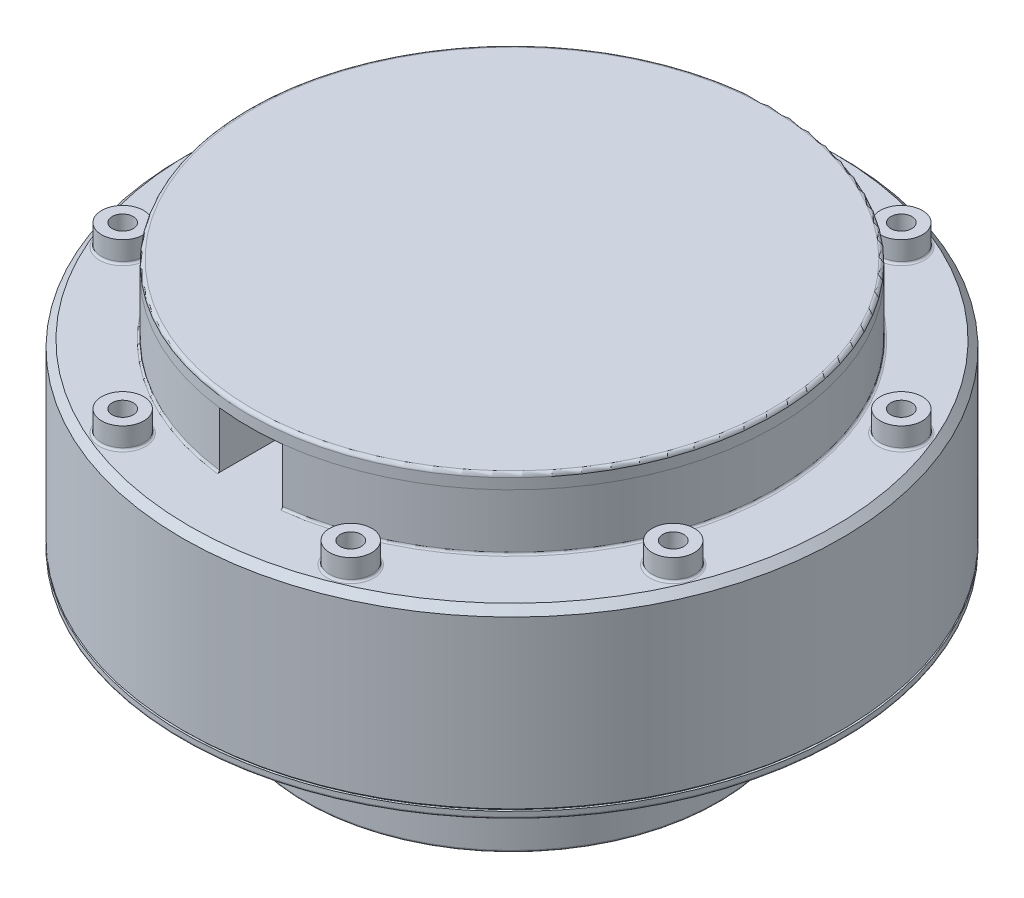
from build123d import *

# Parameters (mm, degrees)
SKETCH_1_R               = 47
SKETCH_1_R_2             = 1.5
EXTRUDE_1_DEPTH          = 25
SKETCH_2_R               = 3
SKETCH_2_R_2             = 1.5
EXTRUDE_2_DEPTH          = 3
EXTRUDE_3_DEPTH          = 8
SKETCH_4_R               = 37.505
EXTRUDE_4_DEPTH          = 2
FILLET_1_R               = 0.5
CHAMFER_1_SIZE           = 1
FILLET_2_R               = 0.3
CHAMFER_2_SIZE           = 0.3
EXTRUDE_START            = 1
SKETCH_5_R               = 47
SKETCH_5_R_2             = 1.5
EXTRUDE_5_DEPTH          = 1
FILLET_3_R               = 0.3
SKETCH_6_R               = 29.5
SKETCH_6_R_2             = 27.5
EXTRUDE_6_DEPTH          = 16.5
SKETCH_7_R               = 27.5
SKETCH_7_R_2             = 22
EXTRUDE_7_DEPTH          = 7.5
SKETCH_8_R               = 21
EXTRUDE_8_DEPTH          = 7
SKETCH_9_R               = 20
EXTRUDE_9_DEPTH          = 10
SKETCH_10_R              = 9.75
CUT_EXTRUDE_1_DEPTH      = 5.5
CUT_EXTRUDE_2_DEPTH      = 5.6
SKETCH_12_R              = 1.5
CUT_EXTRUDE_3_DEPTH      = 6
SKETCH_13_R              = 2
EXTRUDE_10_DEPTH         = 2.6
CHAMFER_3_SIZE           = 0.5
CHAMFER_4_SIZE           = 0.2
FILLET_4_R               = 0.3
CUT_EXTRUDE_4_DEPTH      = 6
CUT_EXTRUDE_4_DEPTH_BACK = 26
SKETCH_15_R              = 19.25


with BuildPart() as part:
    # 草图1 → 凸台-拉伸1 (new body)
    with BuildSketch(Plane(origin=(0, 0, 0), x_dir=(1, 0, 0), z_dir=(0, 1, 0))):
        with Locations(Location((0, 0, 0), (0, 0, 270))):
            Circle(SKETCH_1_R)
        with Locations(Location((-16.264045876, 39.264880132, 0), (0, 0, 270))):
            Circle(SKETCH_1_R_2, mode=Mode.SUBTRACT)
        with Locations(Location((16.264045876, 39.264880132, 0), (0, 0, 270))):
            Circle(SKETCH_1_R_2, mode=Mode.SUBTRACT)
        with Locations(Location((39.264880132, 16.264045876, 0), (0, 0, 270))):
            Circle(SKETCH_1_R_2, mode=Mode.SUBTRACT)
        with Locations(Location((39.264880132, -16.264045876, 0), (0, 0, 270))):
            Circle(SKETCH_1_R_2, mode=Mode.SUBTRACT)
        with Locations(Location((16.264045876, -39.264880132, 0), (0, 0, 270))):
            Circle(SKETCH_1_R_2, mode=Mode.SUBTRACT)
        with Locations(Location((-16.264045876, -39.264880132, 0), (0, 0, 270))):
            Circle(SKETCH_1_R_2, mode=Mode.SUBTRACT)
        with Locations(Location((-39.264880132, -16.264045876, 0), (0, 0, 270))):
            Circle(SKETCH_1_R_2, mode=Mode.SUBTRACT)
        with Locations(Location((-39.264880132, 16.264045876, 0), (0, 0, 270))):
            Circle(SKETCH_1_R_2, mode=Mode.SUBTRACT)
    extrude(amount=EXTRUDE_1_DEPTH)

    # 草图2 → 凸台-拉伸2 (add)
    # profile 1 of 8: a face of its own
    with BuildSketch(Plane(origin=(0, 25, 0), x_dir=(1, 0, 0), z_dir=(0, 1, 0))):
        with Locations(Location((-16.264045876, 39.264880132, 0), (0, 0, 270))):
            Circle(SKETCH_2_R)
        with Locations(Location((-16.264045876, 39.264880132, 0), (0, 0, 270))):
            Circle(SKETCH_2_R_2, mode=Mode.SUBTRACT)
    # profile 2 of 8: a face of its own
    with BuildSketch(Plane(origin=(0, 25, 0), x_dir=(1, 0, 0), z_dir=(0, 1, 0))):
        with Locations(Location((16.264045876, 39.264880132, 0), (0, 0, 270))):
            Circle(SKETCH_2_R)
        with Locations(Location((16.264045876, 39.264880132, 0), (0, 0, 270))):
            Circle(SKETCH_2_R_2, mode=Mode.SUBTRACT)
    # profile 3 of 8: a face of its own
    with BuildSketch(Plane(origin=(0, 25, 0), x_dir=(1, 0, 0), z_dir=(0, 1, 0))):
        with Locations(Location((39.264880132, 16.264045876, 0), (0, 0, 270))):
            Circle(SKETCH_2_R)
        with Locations(Location((39.264880132, 16.264045876, 0), (0, 0, 270))):
            Circle(SKETCH_2_R_2, mode=Mode.SUBTRACT)
    # profile 4 of 8: a face of its own
    with BuildSketch(Plane(origin=(0, 25, 0), x_dir=(1, 0, 0), z_dir=(0, 1, 0))):
        with Locations(Location((39.264880132, -16.264045876, 0), (0, 0, 270))):
            Circle(SKETCH_2_R)
        with Locations(Location((39.264880132, -16.264045876, 0), (0, 0, 270))):
            Circle(SKETCH_2_R_2, mode=Mode.SUBTRACT)
    # profile 5 of 8: a face of its own
    with BuildSketch(Plane(origin=(0, 25, 0), x_dir=(1, 0, 0), z_dir=(0, 1, 0))):
        with Locations(Location((16.264045876, -39.264880132, 0), (0, 0, 270))):
            Circle(SKETCH_2_R)
        with Locations(Location((16.264045876, -39.264880132, 0), (0, 0, 270))):
            Circle(SKETCH_2_R_2, mode=Mode.SUBTRACT)
    # profile 6 of 8: a face of its own
    with BuildSketch(Plane(origin=(0, 25, 0), x_dir=(1, 0, 0), z_dir=(0, 1, 0))):
        with Locations(Location((-16.264045876, -39.264880132, 0), (0, 0, 270))):
            Circle(SKETCH_2_R)
        with Locations(Location((-16.264045876, -39.264880132, 0), (0, 0, 270))):
            Circle(SKETCH_2_R_2, mode=Mode.SUBTRACT)
    # profile 7 of 8: a face of its own
    with BuildSketch(Plane(origin=(0, 25, 0), x_dir=(1, 0, 0), z_dir=(0, 1, 0))):
        with Locations(Location((-39.264880132, -16.264045876, 0), (0, 0, 270))):
            Circle(SKETCH_2_R)
        with Locations(Location((-39.264880132, -16.264045876, 0), (0, 0, 270))):
            Circle(SKETCH_2_R_2, mode=Mode.SUBTRACT)
    # profile 8 of 8: a face of its own
    with BuildSketch(Plane(origin=(0, 25, 0), x_dir=(1, 0, 0), z_dir=(0, 1, 0))):
        with Locations(Location((-39.264880132, 16.264045876, 0), (0, 0, 270))):
            Circle(SKETCH_2_R)
        with Locations(Location((-39.264880132, 16.264045876, 0), (0, 0, 270))):
            Circle(SKETCH_2_R_2, mode=Mode.SUBTRACT)
    extrude(amount=EXTRUDE_2_DEPTH)

    # 草图3 → 凸台-拉伸3 (add)
    with BuildSketch(Plane(origin=(0, 25, 0), x_dir=(1, 0, 0), z_dir=(0, 1, 0))):
        with BuildLine():
            Line((-4.5, -37.229020938), (-4.5, 0))
            Line((-4.5, 0), (4.5, 0))
            Line((4.5, 0), (4.5, -37.229020938))
            ThreePointArc((4.5, -37.229020938), (28.062430401, -24.874685928), (37.5, 0))
            ThreePointArc((37.5, 0), (-24.874685928, 28.062430401), (-4.5, -37.229020938))
        make_face()
    extrude(amount=EXTRUDE_3_DEPTH)

    # 草图4 → 凸台-拉伸4 (add)
    with BuildSketch(Plane(origin=(0, 33, 0), x_dir=(1, 0, 0), z_dir=(0, 1, 0))):
        with Locations(Location((0, 0, 0), (0, 0, 263.108169794))):
            Circle(SKETCH_4_R)
    extrude(amount=EXTRUDE_4_DEPTH)

    # 圆角1
    fillet_1_edges = [part.edges().sort_by_distance(p)[0] for p in [
        (4.500422997, 35, -37.234006202),
    ]]
    fillet(fillet_1_edges, radius=FILLET_1_R)

    # 倒角1
    chamfer_1_edges = [part.edges().sort_by_distance(p)[0] for p in [
        (0, 25, -47),
    ]]
    chamfer(chamfer_1_edges, length=CHAMFER_1_SIZE)

    # 圆角2
    fillet_2_edges = [part.edges().sort_by_distance(p)[0] for p in [
        (-16.264045876, 25, -42.264880132),
        (16.264045876, 25, -42.264880132),
        (39.264880132, 25, -19.264045876),
        (39.264880132, 25, 13.264045876),
        (16.264045876, 25, 36.264880132),
        (-16.264045876, 25, 36.264880132),
        (-39.264880132, 25, 13.264045876),
        (-39.264880132, 25, -19.264045876),
        (0, 25, -37.5),
    ]]
    fillet(fillet_2_edges, radius=FILLET_2_R)

    # 倒角2
    chamfer_2_edges = [part.edges().sort_by_distance(p)[0] for p in [
        (0, 0, -47),
    ]]
    chamfer(chamfer_2_edges, length=CHAMFER_2_SIZE)

    # 草图5 → 凸台-拉伸5 (add)
    with BuildSketch(Plane.XZ.offset(EXTRUDE_START)):
        with Locations(Location((0, 0, 0), (0, 0, 90))):
            Circle(SKETCH_5_R)
        with Locations(Location((16.264045876, -39.264880132, 0), (0, 0, 270))):
            Circle(SKETCH_5_R_2, mode=Mode.SUBTRACT)
        with Locations(Location((-16.264045876, -39.264880132, 0), (0, 0, 270))):
            Circle(SKETCH_5_R_2, mode=Mode.SUBTRACT)
        with Locations(Location((39.264880132, -16.264045876, 0), (0, 0, 270))):
            Circle(SKETCH_5_R_2, mode=Mode.SUBTRACT)
        with Locations(Location((39.264880132, 16.264045876, 0), (0, 0, 270))):
            Circle(SKETCH_5_R_2, mode=Mode.SUBTRACT)
        with Locations(Location((16.264045876, 39.264880132, 0), (0, 0, 270))):
            Circle(SKETCH_5_R_2, mode=Mode.SUBTRACT)
        with Locations(Location((-16.264045876, 39.264880132, 0), (0, 0, 270))):
            Circle(SKETCH_5_R_2, mode=Mode.SUBTRACT)
        with Locations(Location((-39.264880132, 16.264045876, 0), (0, 0, 270))):
            Circle(SKETCH_5_R_2, mode=Mode.SUBTRACT)
        with Locations(Location((-39.264880132, -16.264045876, 0), (0, 0, 270))):
            Circle(SKETCH_5_R_2, mode=Mode.SUBTRACT)
    extrude(amount=-EXTRUDE_5_DEPTH)

    # 圆角3
    fillet_3_edges = [part.edges().sort_by_distance(p)[0] for p in [
        (0, -1, -47),
    ]]
    fillet(fillet_3_edges, radius=FILLET_3_R)

    # 草图6 → 凸台-拉伸6 (add)
    with BuildSketch(Plane.XZ.offset(1)):
        with Locations(Location((0, 0, 0), (0, 0, 270))):
            Circle(SKETCH_6_R)
        with Locations(Location((0, 0, 0), (0, 0, 270))):
            Circle(SKETCH_6_R_2, mode=Mode.SUBTRACT)
    extrude(amount=EXTRUDE_6_DEPTH)

    # 草图7 → 凸台-拉伸7 (add)
    with BuildSketch(Plane.XZ.offset(1)):
        with Locations(Location((0, 0, 0), (0, 0, 270))):
            Circle(SKETCH_7_R)
        with Locations(Location((0, 0, 0), (0, 0, 270))):
            Circle(SKETCH_7_R_2, mode=Mode.SUBTRACT)
    extrude(amount=EXTRUDE_7_DEPTH)

    # 草图8 → 凸台-拉伸8 (add)
    with BuildSketch(Plane.XZ.offset(1)):
        with Locations(Location((0, 0, 0), (0, 0, 270))):
            Circle(SKETCH_8_R)
    extrude(amount=EXTRUDE_8_DEPTH)

    # 草图9 → 凸台-拉伸9 (add)
    with BuildSketch(Plane.XZ.offset(8)):
        with Locations(Location((0, 0, 0), (0, 0, 270))):
            Circle(SKETCH_9_R)
    extrude(amount=EXTRUDE_9_DEPTH)

    # 草图10 → 切除-拉伸1 (cut)
    with BuildSketch(Plane.XZ.offset(18)):
        with Locations(Location((0, 0, 0), (0, 0, 270))):
            Circle(SKETCH_10_R)
    extrude(amount=-CUT_EXTRUDE_1_DEPTH, mode=Mode.SUBTRACT)

    # 草图11 → 切除-拉伸2 (cut)
    with BuildSketch(Plane.XZ.offset(18)):
        with BuildLine():
            Line((0, 12.961481397), (0, 15.968719423))
            ThreePointArc((0, 15.968719423), (0.315346803, 16.69758841), (1.0625, 16.966764387))
            ThreePointArc((1.0625, 16.966764387), (4.958333333, 16.260840401), (8.585218328, 14.672901085))
            ThreePointArc((8.585218328, 14.672901085), (9.055059586, 14.03263333), (8.910066596, 13.251819243))
            Line((8.910066596, 13.251819243), (7.232117953, 10.756229354))
            ThreePointArc((7.232117953, 10.756229354), (6.632142436, 10.340981707), (5.909775547, 10.443876339))
            ThreePointArc((5.909775547, 10.443876339), (3.5, 11.478240283), (0.923076923, 11.964444366))
            ThreePointArc((0.923076923, 11.964444366), (0.266200614, 12.282115176), (0, 12.961481397))
        make_face()
        with BuildLine():
            Line((5.699108892, -11.641312548), (7.021378813, -14.342253643))
            ThreePointArc((7.021378813, -14.342253643), (7.625087153, -14.8582283), (8.414495923, -14.771467712))
            ThreePointArc((8.414495923, -14.771467712), (11.603134208, -12.424462828), (14.162398979, -9.403534185))
            ThreePointArc((14.162398979, -9.403534185), (14.302862343, -8.621892547), (13.829316686, -7.984359711))
            Line((13.829316686, -7.984359711), (11.22497216, -6.480740698))
            ThreePointArc((11.22497216, -6.480740698), (10.503523448, -6.371594083), (9.899974302, -6.781630248))
            ThreePointArc((9.899974302, -6.781630248), (8.190447676, -8.770209055), (6.08977445, -10.339953924))
            ThreePointArc((6.08977445, -10.339953924), (5.63948164, -10.914094685), (5.699108892, -11.641312548))
        make_face()
        with BuildLine():
            Line((-12.931226846, 0.885083194), (-15.931445409, 1.0904344))
            ThreePointArc((-15.931445409, 1.0904344), (-16.680146739, 0.825594969), (-16.999714251, 0.098566626))
            ThreePointArc((-16.999714251, 0.098566626), (-16.561467541, -3.836377574), (-15.224898979, -7.563230202))
            ThreePointArc((-15.224898979, -7.563230202), (-14.618209146, -8.075695862), (-13.829316686, -7.984359711))
            Line((-13.829316686, -7.984359711), (-11.22497216, -6.480740698))
            ThreePointArc((-11.22497216, -6.480740698), (-10.769724062, -5.910521094), (-10.823051225, -5.182814118))
            ThreePointArc((-10.823051225, -5.182814118), (-11.690447676, -2.708031228), (-11.999549997, -0.103922415))
            ThreePointArc((-11.999549997, -0.103922415), (-12.271624077, 0.573112978), (-12.931226846, 0.885083194))
        make_face()
    extrude(amount=-CUT_EXTRUDE_2_DEPTH, mode=Mode.SUBTRACT)

    # 草图12 → 切除-拉伸3 (cut)
    with BuildSketch(Plane.XZ.offset(18)):
        with Locations(Location((-3.061820011, 13.217737762, 0), (0, 0, 270))):
            Circle(SKETCH_12_R)
        with Locations(Location((9.915986677, 9.260482792, 0), (0, 0, 270))):
            Circle(SKETCH_12_R)
        with Locations(Location((12.977806688, -3.95725497, 0), (0, 0, 270))):
            Circle(SKETCH_12_R)
        with Locations(Location((3.061820011, -13.217737762, 0), (0, 0, 270))):
            Circle(SKETCH_12_R)
        with Locations(Location((-9.915986677, -9.260482792, 0), (0, 0, 270))):
            Circle(SKETCH_12_R)
        with Locations(Location((-12.977806688, 3.95725497, 0), (0, 0, 270))):
            Circle(SKETCH_12_R)
    extrude(amount=-CUT_EXTRUDE_3_DEPTH, mode=Mode.SUBTRACT)

    # 草图13 → 凸台-拉伸10 (add)
    with BuildSketch(Plane.XZ.offset(18)):
        with Locations(Location((-9.457514341, 10.126965117, 0), (0, 0, 270))):
            Circle(SKETCH_13_R)
        with Locations(Location((13.498966225, 3.126965117, 0), (0, 0, 270))):
            Circle(SKETCH_13_R)
        with Locations(Location((-4.041451884, -13.253930235, 0), (0, 0, 270))):
            Circle(SKETCH_13_R)
    extrude(amount=EXTRUDE_10_DEPTH)

    # 倒角3
    chamfer_3_edges = [part.edges().sort_by_distance(p)[0] for p in [
        (0, -18, 20),
    ]]
    chamfer(chamfer_3_edges, length=CHAMFER_3_SIZE)

    # 倒角4
    chamfer_4_edges = [part.edges().sort_by_distance(p)[0] for p in [
        (0, -18, 9.75),
        (9.055059586, -18, 14.03263333),
        (4.958333333, -18, 16.260840401),
        (0.315346803, -18, 16.69758841),
        (0, -18, 14.46510041),
        (0.266200614, -18, 12.282115176),
        (3.5, -18, 11.478240283),
        (6.632142436, -18, 10.340981707),
        (8.071092275, -18, 12.004024298),
        (7.625087153, -18, -14.8582283),
        (11.603134208, -18, -12.424462828),
        (14.302862343, -18, -8.621892547),
        (12.527144423, -18, -7.232550205),
        (10.503523448, -18, -6.371594083),
        (8.190447676, -18, -8.770209055),
        (5.63948164, -18, -10.914094685),
        (6.360243853, -18, -12.991783095),
        (-16.680146739, -18, 0.825594969),
        (-16.561467541, -18, -3.836377574),
        (-14.618209146, -18, -8.075695862),
        (-12.527144423, -18, -7.232550205),
        (-10.769724062, -18, -5.910521094),
        (-11.690447676, -18, -2.708031228),
        (-12.271624077, -18, 0.573112978),
        (-14.431336127, -18, 0.987758797),
        (-3.061820011, -18, 14.717737762),
        (9.915986677, -18, 10.760482792),
        (12.977806688, -18, -2.45725497),
        (3.061820011, -18, -11.717737762),
        (-9.915986677, -18, -7.760482792),
        (-12.977806688, -18, 5.45725497),
        (13.498966225, -20.6, 5.126965117),
        (-9.457514341, -20.6, 12.126965117),
        (-4.041451884, -20.6, -11.253930235),
    ]]
    chamfer(chamfer_4_edges, length=CHAMFER_4_SIZE)

    # 圆角4
    fillet_4_edges = [part.edges().sort_by_distance(p)[0] for p in [
        (0, -17.5, 29.5),
        (0, -1, 29.5),
        (0, -17.5, 27.5),
        (0, -8.5, 27.5),
        (0, -8, 20),
    ]]
    fillet(fillet_4_edges, radius=FILLET_4_R)

    # 草图15 → 切除-拉伸4 (cut, two sides: drawn at the far end of the back side and taken through both)
    with BuildSketch(Plane.XZ.offset(1).offset(-CUT_EXTRUDE_4_DEPTH_BACK)):
        with Locations(Location((0, 0, 0), (0, 0, 103.51890764))):
            Circle(SKETCH_15_R)
    extrude(amount=CUT_EXTRUDE_4_DEPTH + CUT_EXTRUDE_4_DEPTH_BACK, mode=Mode.SUBTRACT)


solid = part.part
